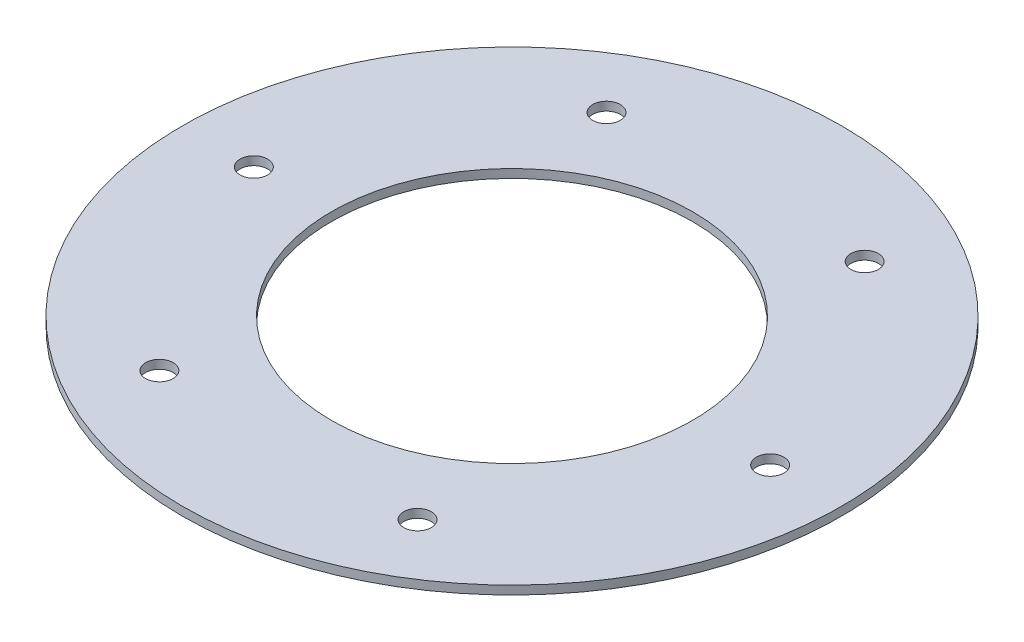
from build123d import *

# Parameters (mm, degrees)
SKETCH1_R           = 38.3
SKETCH1_R_2         = 1.6
SKETCH1_R_3         = 21
BOSS_EXTRUDE1_DEPTH = 1


with BuildPart() as part:
    # Sketch1 → Boss-Extrude1 (new body)
    with BuildSketch(Plane(origin=(0, 0, 0), x_dir=(1, 0, 0), z_dir=(0, 1, 0))):
        with Locations(Location((0, 0, 0), (0, 0, 270))):
            Circle(SKETCH1_R)
        with Locations(Location((30, 0, 0), (0, 0, 270))):
            Circle(SKETCH1_R_2, mode=Mode.SUBTRACT)
        with Locations(Location((0, 0, 0), (0, 0, 270))):
            Circle(SKETCH1_R_3, mode=Mode.SUBTRACT)
        with Locations(Location((15, -25.980762114, 0), (0, 0, 270))):
            Circle(SKETCH1_R_2, mode=Mode.SUBTRACT)
        with Locations(Location((-15, -25.980762114, 0), (0, 0, 270))):
            Circle(SKETCH1_R_2, mode=Mode.SUBTRACT)
        with Locations(Location((-30, 0, 0), (0, 0, 270))):
            Circle(SKETCH1_R_2, mode=Mode.SUBTRACT)
        with Locations(Location((-15, 25.980762114, 0), (0, 0, 270))):
            Circle(SKETCH1_R_2, mode=Mode.SUBTRACT)
        with Locations(Location((15, 25.980762114, 0), (0, 0, 270))):
            Circle(SKETCH1_R_2, mode=Mode.SUBTRACT)
    extrude(amount=BOSS_EXTRUDE1_DEPTH)


solid = part.part
